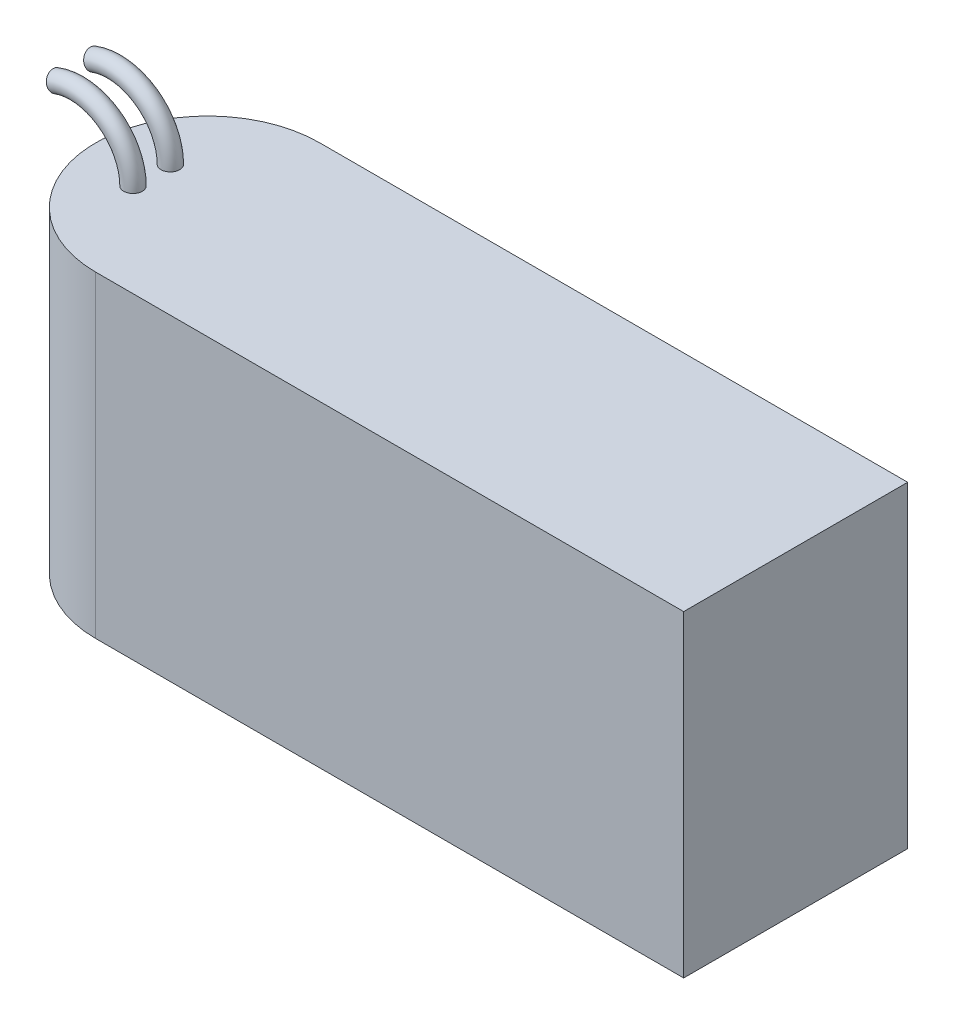
from build123d import *

# Parameters (mm, degrees)
BOSS_EXTRUDE1_DEPTH = 34
SWEEP2_PROFILE_R    = 1
LPATTERN1_COUNT     = 2
LPATTERN1_PITCH     = 4


with BuildPart() as part:
    # Sketch1 → Boss-Extrude1 (new body)
    with BuildSketch(Plane(origin=(0, 0, 0), x_dir=(1, 0, 0), z_dir=(0, 1, 0))):
        with BuildLine():
            Line((0, 0), (63, 0))
            Line((63, 0), (63, 24))
            Line((63, 24), (0, 24))
            ThreePointArc((0, 24), (-12, 12), (0, 0))
        make_face()
    extrude(amount=BOSS_EXTRUDE1_DEPTH)

    # Sweep2: sweep along a path in Sketch21
    with BuildLine(Plane(origin=(0, 0, -14), x_dir=(-1, 0, 0), z_dir=(0, 0, -1))) as sweep2_path:
        ThreePointArc((6, 34), (8.626551961, 38.989949378), (14.22684679, 39.649546094))
    # Sweep2 profile (on start of the path) → Sweep2 (sweep)
    with BuildSketch(Plane(origin=(-6, 34, -14), x_dir=(1, 0, 0), z_dir=(0, 1, 0))):
        Circle(SWEEP2_PROFILE_R)
    sweep2 = sweep(path=sweep2_path.line)

    # LPattern1: Sweep2 ×2
    with Locations(*[(0, 0, i * LPATTERN1_PITCH) for i in range(1, LPATTERN1_COUNT)]):
        add(sweep2)


solid = part.part
